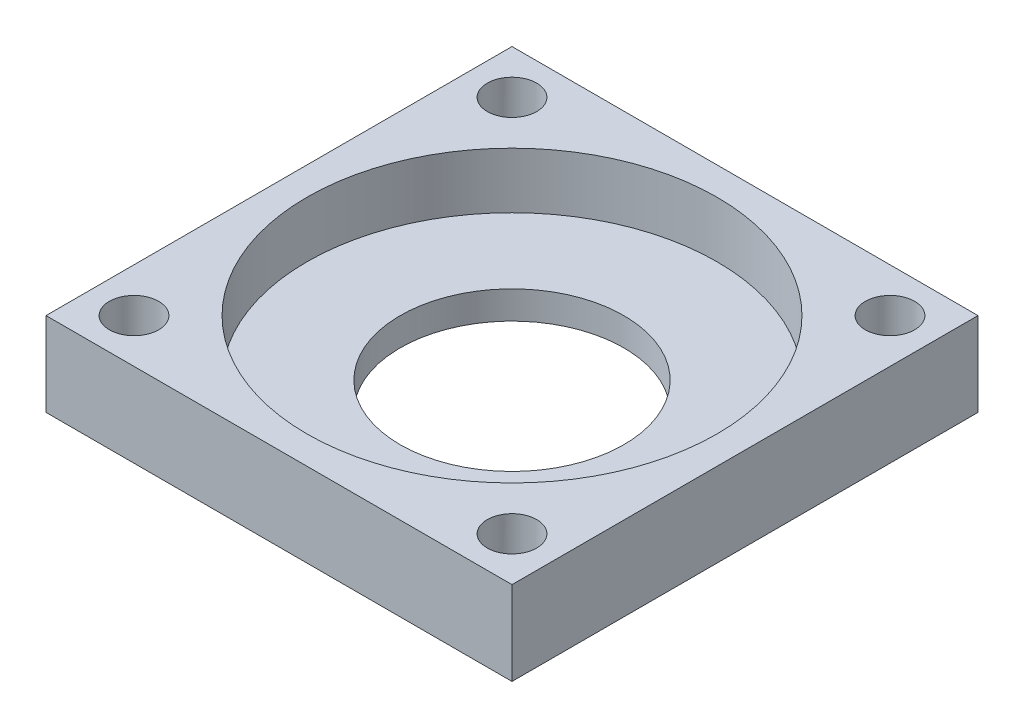
from build123d import *

# Parameters (mm, degrees)
SKETCH1_W           = 50
SKETCH1_H           = 50
SKETCH1_R           = 12
BOSS_EXTRUDE1_DEPTH = 3
SKETCH2_W           = 50
SKETCH2_H           = 50
SKETCH2_R           = 22
BOSS_EXTRUDE2_DEPTH = 6
SKETCH3_R           = 2.65
CUT_EXTRUDE1_DEPTH  = 30


with BuildPart() as part:
    # Sketch1 → Boss-Extrude1 (new body)
    with BuildSketch(Plane(origin=(0, 0, 0), x_dir=(1, 0, 0), z_dir=(0, 1, 0))):
        Rectangle(SKETCH1_W, SKETCH1_H)
        with Locations(Location((0, 0, 0), (0, 0, 270))):
            Circle(SKETCH1_R, mode=Mode.SUBTRACT)
    extrude(amount=BOSS_EXTRUDE1_DEPTH)

    # Sketch2 → Boss-Extrude2 (add)
    with BuildSketch(Plane(origin=(0, 3, 0), x_dir=(1, 0, 0), z_dir=(0, 1, 0))):
        Rectangle(SKETCH2_W, SKETCH2_H)
        with Locations(Location((0, 0, 0), (0, 0, 270))):
            Circle(SKETCH2_R, mode=Mode.SUBTRACT)
    extrude(amount=BOSS_EXTRUDE2_DEPTH)

    # Sketch3 → Cut-Extrude1 (cut)
    with BuildSketch(Plane(origin=(0, 9, 0), x_dir=(1, 0, 0), z_dir=(0, 1, 0))):
        with Locations(Location((-20.278174593, 20.278174593, 0), (0, 0, 270))):
            Circle(SKETCH3_R)
        with Locations(Location((-20.278174593, -20.278174593, 0), (0, 0, 90))):
            Circle(SKETCH3_R)
        with Locations(Location((20.278174593, -20.278174593, 0), (0, 0, 270))):
            Circle(SKETCH3_R)
        with Locations(Location((20.278174593, 20.278174593, 0), (0, 0, 90))):
            Circle(SKETCH3_R)
    extrude(amount=-CUT_EXTRUDE1_DEPTH, mode=Mode.SUBTRACT)


solid = part.part
